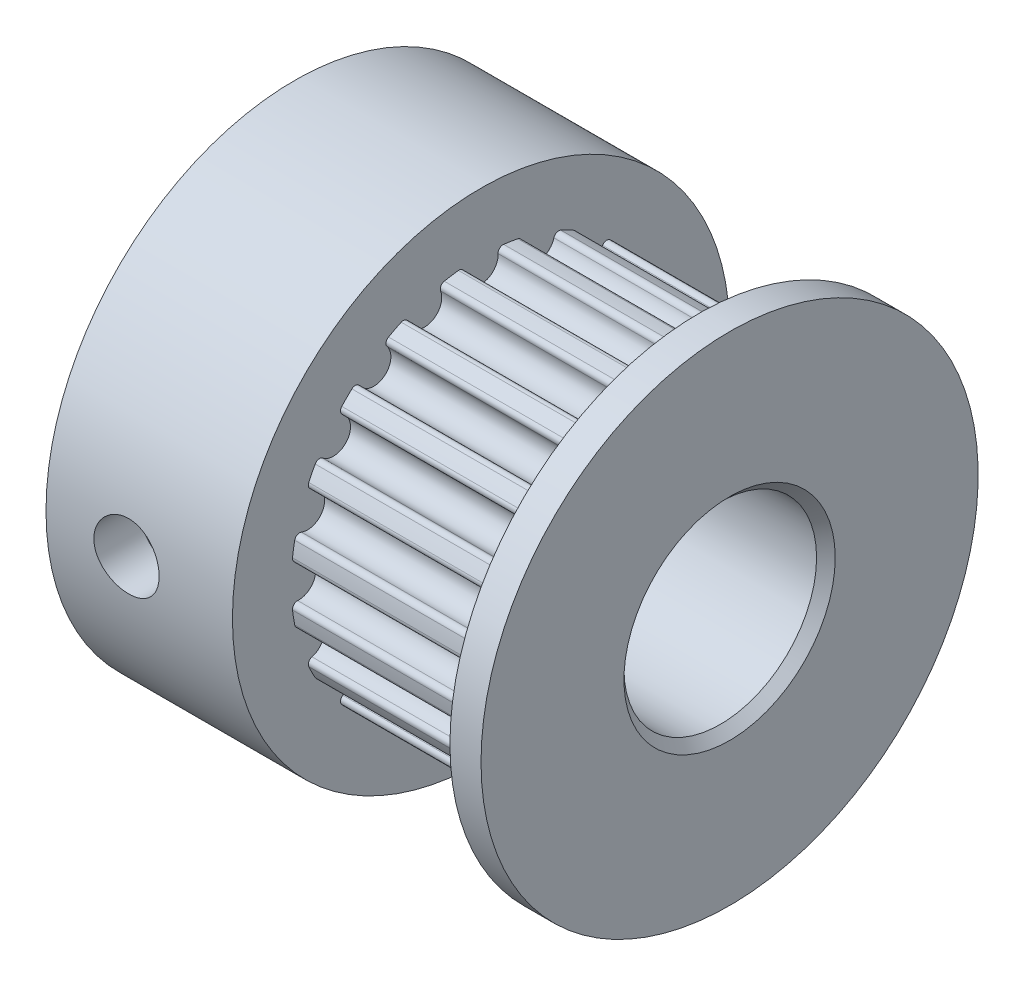
from build123d import *

# Parameters (mm, degrees)
SKETCH_2_R                     = 3.1
BORE_DEPTH                     = 19
SKETCH_3_R                     = 0.55
CUT_EXTRUDE_20T_DEPTH          = 7
FILLET_2_R                     = 0.16
CHAMFER2_SIZE                  = 0.3
SKETCH1_W                      = 1.7
SKETCH1_H                      = 4.1
SKETCH1_W_2                    = 4.1
SKETCH1_H_2                    = 1.7
CUT_EXTRUDE1_DEPTH             = 5
CUT_EXTRUDE2_REACH             = 22.587
SKETCH2_R                      = 1.05
CUT_EXTRUDE2_DIRECTION_2_DEPTH = 21.587374873
CUT_EXTRUDE3_REACH             = 22.587
SKETCH3_R                      = 1.05
CUT_EXTRUDE3_DIRECTION_2_DEPTH = 21.587374873


with BuildPart() as part:
    # Эскиз1 → Body (revolve)
    with BuildSketch(Plane.XY, mode=Mode.PRIVATE) as body_sk:
        Polygon((0, 7.213189396), (0, 0), (14, 0), (14, 8), (13, 8), (13, 7.213189396), (13, 6.11), (6, 6.11), (6, 7.213189396), (6, 8), (0, 8), align=None)
    revolve(body_sk.sketch.rotate(Axis((0, 0, 0), (1, 0, 0)), 90), axis=Axis((0, 0, 0), (1, 0, 0)))

    # Эскиз2 → Bore (cut, through all)
    with BuildSketch(Plane(origin=(14, 0, 0), x_dir=(0, 0, -1), z_dir=(1, 0, 0))):
        Circle(SKETCH_2_R)
    extrude(amount=-BORE_DEPTH, mode=Mode.SUBTRACT)

    # Эскиз3 → 20T (cut)
    with BuildSketch(Plane(origin=(6, 0, 0), x_dir=(0, 0, -1), z_dir=(1, 0, 0))):
        with Locations((5.582701751, -1.813929757)):
            Circle(SKETCH_3_R)
        with Locations((4.748929757, -3.450299431)):
            Circle(SKETCH_3_R)
        with Locations((3.450299431, -4.748929757)):
            Circle(SKETCH_3_R)
        with Locations((1.813929757, -5.582701751)):
            Circle(SKETCH_3_R)
        with Locations((0, -5.87)):
            Circle(SKETCH_3_R)
        with Locations((5.87, 0)):
            Circle(SKETCH_3_R)
        with Locations((-1.813929757, -5.582701751)):
            Circle(SKETCH_3_R)
        with Locations((-3.450299431, -4.748929757)):
            Circle(SKETCH_3_R)
        with Locations((-4.748929757, -3.450299431)):
            Circle(SKETCH_3_R)
        with Locations((-5.582701751, -1.813929757)):
            Circle(SKETCH_3_R)
        with Locations((-5.87, 0)):
            Circle(SKETCH_3_R)
        with Locations((-5.582701751, 1.813929757)):
            Circle(SKETCH_3_R)
        with Locations((-4.748929757, 3.450299431)):
            Circle(SKETCH_3_R)
        with Locations((-3.450299431, 4.748929757)):
            Circle(SKETCH_3_R)
        with Locations((-1.813929757, 5.582701751)):
            Circle(SKETCH_3_R)
        with Locations((0, 5.87)):
            Circle(SKETCH_3_R)
        with Locations((1.813929757, 5.582701751)):
            Circle(SKETCH_3_R)
        with Locations((3.450299431, 4.748929757)):
            Circle(SKETCH_3_R)
        with Locations((4.748929757, 3.450299431)):
            Circle(SKETCH_3_R)
        with Locations((5.582701751, 1.813929757)):
            Circle(SKETCH_3_R)
    extrude(amount=CUT_EXTRUDE_20T_DEPTH, mode=Mode.SUBTRACT)

    # Fillet 2
    fillet_2_edges = [part.edges().sort_by_distance(p)[0] for p in [
        (9.5, -3.170991479, 5.22273042),
        (9.5, -3.987221543, 4.629704566),
        (9.5, -1.401879653, 5.947002055),
        (9.5, -2.36141564, 5.635229913),
        (9.5, 0.504457922, 6.089139693),
        (9.5, -0.504457922, 6.089139693),
        (9.5, 2.36141564, 5.635229913),
        (9.5, 1.401879653, 5.947002055),
        (9.5, 3.987221543, 4.629704566),
        (9.5, 3.170991479, 5.22273042),
        (9.5, 5.22273042, 3.170991479),
        (9.5, 4.629704566, 3.987221543),
        (9.5, 5.947002055, 1.401879653),
        (9.5, 5.635229913, 2.36141564),
        (9.5, 6.089139693, -0.504457922),
        (9.5, 6.089139693, 0.504457922),
        (9.5, 5.635229913, -2.36141564),
        (9.5, 5.947002055, -1.401879653),
        (9.5, 4.629704566, -3.987221543),
        (9.5, 5.22273042, -3.170991479),
        (9.5, 3.170991479, -5.22273042),
        (9.5, 3.987221543, -4.629704566),
        (9.5, 1.401879653, -5.947002055),
        (9.5, 2.36141564, -5.635229913),
        (9.5, -2.36141564, -5.635229913),
        (9.5, -1.401879653, -5.947002055),
        (9.5, -3.987221543, -4.629704566),
        (9.5, -3.170991479, -5.22273042),
        (9.5, -5.22273042, -3.170991479),
        (9.5, -4.629704566, -3.987221543),
        (9.5, -5.947002055, -1.401879653),
        (9.5, -5.635229913, -2.36141564),
        (9.5, -6.089139693, 0.504457922),
        (9.5, -6.089139693, -0.504457922),
        (9.5, -0.504457922, -6.089139693),
        (9.5, 0.504457922, -6.089139693),
        (9.5, -5.635229913, 2.36141564),
        (9.5, -5.947002055, 1.401879653),
        (9.5, -4.629704566, 3.987221543),
        (9.5, -5.22273042, 3.170991479),
    ]]
    fillet(fillet_2_edges, radius=FILLET_2_R)

    # Chamfer2
    chamfer2_edges = [part.edges().sort_by_distance(p)[0] for p in [
        (0, 0, 3.1),
        (14, 0, 3.1),
    ]]
    chamfer(chamfer2_edges, length=CHAMFER2_SIZE)

    # Sketch1 → Cut-Extrude1 (cut)
    with BuildSketch(Plane.ZY):
        with Locations((5.65, 0)):
            Rectangle(SKETCH1_W, SKETCH1_H)
        with Locations((0, -5.65)):
            Rectangle(SKETCH1_W_2, SKETCH1_H_2)
    extrude(amount=-CUT_EXTRUDE1_DEPTH, mode=Mode.SUBTRACT)

    # Sketch2 → Cut-Extrude2 (cut, up to next)
    with BuildSketch(Plane.XY.offset(4.8), mode=Mode.PRIVATE) as cut_extrude2_sk1:
        with Locations((2.590598923, 0)):
            Circle(SKETCH2_R)
    cut_extrude2_tool1 = extrude(cut_extrude2_sk1.sketch, amount=-CUT_EXTRUDE2_REACH, mode=Mode.PRIVATE) & part.part
    add(cut_extrude2_tool1.solids().sort_by_distance((2.590599, 0, 4.8))[0], mode=Mode.SUBTRACT)

    # Sketch2 → Cut-Extrude2 direction 2 (cut)
    with BuildSketch(Plane.XY.offset(4.8)):
        with Locations((2.590598923, 0)):
            Circle(SKETCH2_R)
    extrude(amount=CUT_EXTRUDE2_DIRECTION_2_DEPTH, mode=Mode.SUBTRACT)

    # Sketch3 → Cut-Extrude3 (cut, up to next)
    with BuildSketch(Plane.XZ.offset(4.8), mode=Mode.PRIVATE) as cut_extrude3_sk1:
        with Locations(Location((2.590598923, 0, 0), (0, 0, 180))):
            Circle(SKETCH3_R)
    cut_extrude3_tool1 = extrude(cut_extrude3_sk1.sketch, amount=-CUT_EXTRUDE3_REACH, mode=Mode.PRIVATE) & part.part
    add(cut_extrude3_tool1.solids().sort_by_distance((2.590599, -4.8, 0))[0], mode=Mode.SUBTRACT)

    # Sketch3 → Cut-Extrude3 direction 2 (cut)
    with BuildSketch(Plane.XZ.offset(4.8)):
        with Locations(Location((2.590598923, 0, 0), (0, 0, 180))):
            Circle(SKETCH3_R)
    extrude(amount=CUT_EXTRUDE3_DIRECTION_2_DEPTH, mode=Mode.SUBTRACT)


solid = part.part
